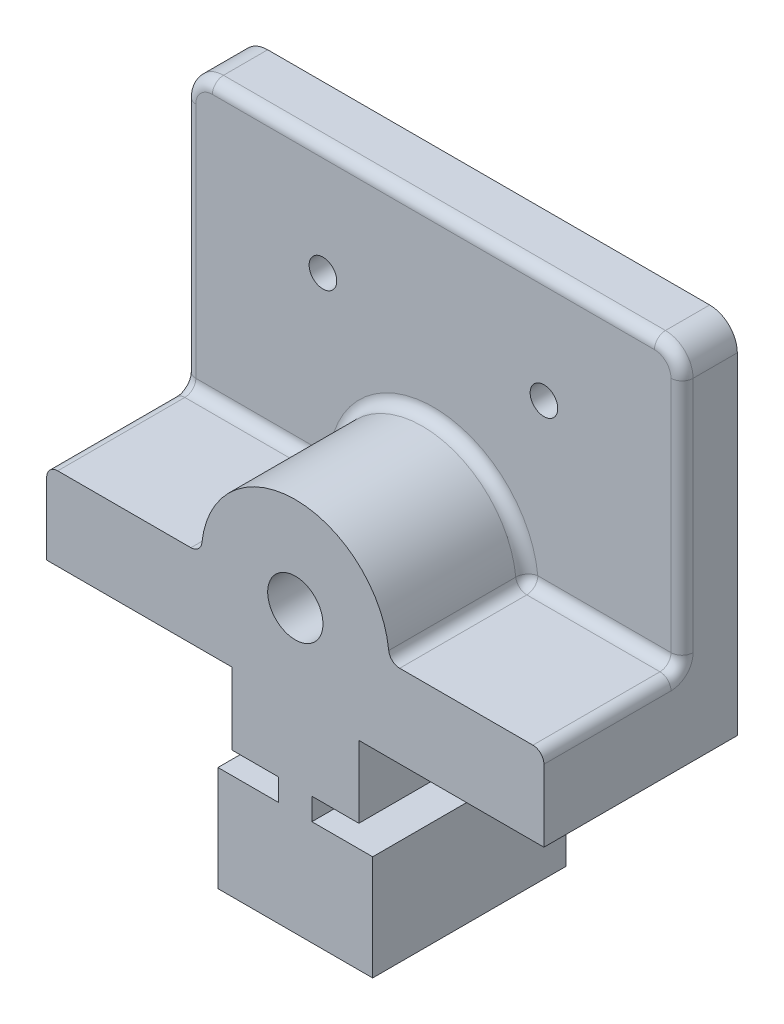
from build123d import *

# Parameters (mm, degrees)
SKETCH_2_W          = 90
SKETCH_2_H          = 101
EXTRUDE_1_DEPTH     = 35
CUT_EXTRUDE_START   = 10
CUT_EXTRUDE_1_DEPTH = 67.491829629
SKETCH_8_R          = 5
CUT_EXTRUDE_3_DEPTH = 77.491829629
SKETCH_9_W          = 23
SKETCH_9_H          = 4
CUT_EXTRUDE_4_DEPTH = 10
HOLE_WIZARD_M5_1_D  = 5
SKETCH_12_R         = 8
CUT_EXTRUDE_5_DEPTH = 5
FILLET_3_R          = 5
FILLET_4_R          = 2


with BuildPart() as part:
    # 草图2 → 凸台-拉伸1 (new body)
    with BuildSketch(Plane.XY):
        with Locations((0, -0.5)):
            Rectangle(SKETCH_2_W, SKETCH_2_H)
    extrude(amount=EXTRUDE_1_DEPTH)

    # 草图3 → 切除-拉伸1 (cut, through all)
    with BuildSketch(Plane.XY.offset(CUT_EXTRUDE_START)):
        with BuildLine():
            Line((45, 50), (-45, 50))
            Line((-45, 50), (-45, 0))
            Line((-45, 0), (-17, 0))
            ThreePointArc((-17, 0), (0, 17), (17, 0))
            Line((17, 0), (45, 0))
            Line((45, 0), (45, 50))
        make_face()
    extrude(amount=CUT_EXTRUDE_1_DEPTH, mode=Mode.SUBTRACT)

    # 草图8 → 切除-拉伸3 (cut, through all)
    with BuildSketch(Plane.XY.offset(35)):
        Circle(SKETCH_8_R)
        Polygon((-45, -15), (-11.5, -15), (-11.5, -28), (-3, -28), (-3, -32), (-14, -32), (-14, -51), (-45, -51), align=None)
        Polygon((45, -51), (45, -15), (11.5, -15), (11.5, -28), (3, -28), (3, -32), (14, -32), (14, -51), align=None)
    extrude(amount=-CUT_EXTRUDE_3_DEPTH, mode=Mode.SUBTRACT)

    # 草图9 → 切除-拉伸4 (cut)
    with BuildSketch(Plane(origin=(0, 0, 0), x_dir=(-1, 0, 0), z_dir=(0, 0, -1))):
        with Locations((0, -17)):
            Rectangle(SKETCH_9_W, SKETCH_9_H)
    extrude(amount=-CUT_EXTRUDE_4_DEPTH, mode=Mode.SUBTRACT)

    # M5 螺纹孔1 (through all)
    with Locations(Plane.XY.offset(10)):
        with Locations((-20, 30), (20, 30)):
            Hole(HOLE_WIZARD_M5_1_D / 2)

    # 草图12 → 切除-拉伸5 (cut)
    with BuildSketch(Plane(origin=(0, 0, 0), x_dir=(-1, 0, 0), z_dir=(0, 0, -1))):
        Circle(SKETCH_12_R)
    extrude(amount=-CUT_EXTRUDE_5_DEPTH, mode=Mode.SUBTRACT)

    # 圆角3
    fillet_3_edges = [part.edges().sort_by_distance(p)[0] for p in [
        (-45, 50, 5),
        (45, 50, 5),
    ]]
    fillet(fillet_3_edges, radius=FILLET_3_R)

    # 圆角4
    fillet_4_edges = [part.edges().sort_by_distance(p)[0] for p in [
        (0, 50, 10),
        (-45, 22.5, 10),
        (-43.535533906, 48.535533906, 10),
        (43.535533906, 48.535533906, 10),
        (45, 22.5, 10),
        (45, 0, 22.5),
        (-31, 0, 10),
        (-45, 0, 22.5),
        (0, 17, 10),
        (-17, 0, 22.5),
        (31, 0, 10),
        (17, 0, 22.5),
    ]]
    fillet(fillet_4_edges, radius=FILLET_4_R)


solid = part.part
